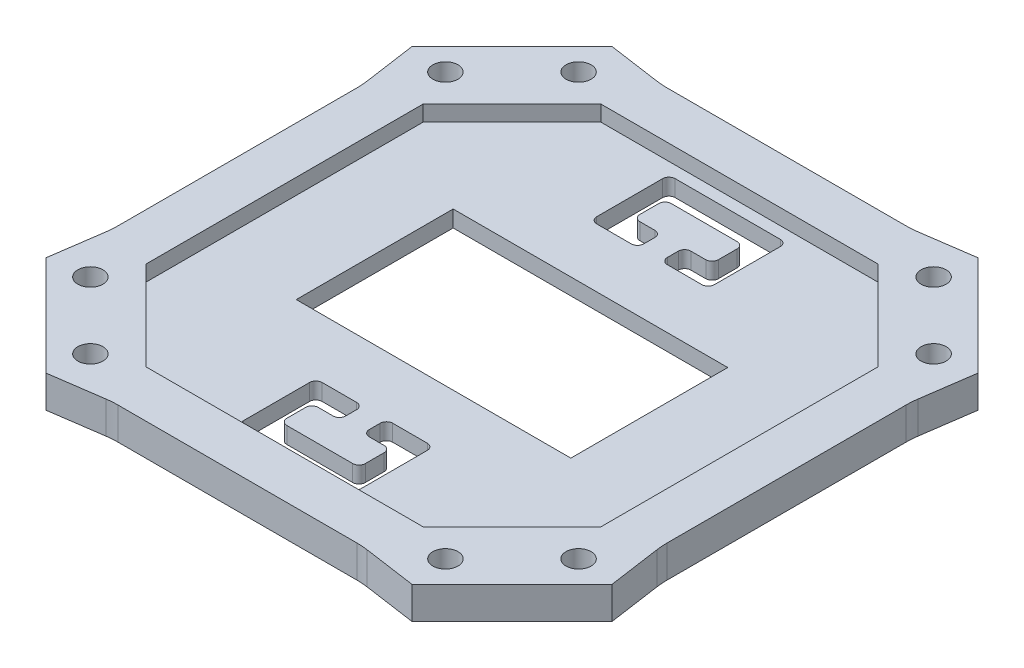
from build123d import *

# Parameters (mm, degrees)
SKETCH1_R           = 1.6
BOSS_EXTRUDE1_DEPTH = 4.1
CUT_EXTRUDE1_DEPTH  = 2
FILLET2_R           = 10
CUT_EXTRUDE4_DEPTH  = 52.043216983
SKETCH7_W           = 35
SKETCH7_H           = 20
CUT_EXTRUDE5_DEPTH  = 52.043216983


with BuildPart() as part:
    # Sketch1 → Boss-Extrude1 (new body)
    with BuildSketch(Plane(origin=(0, 0, 0), x_dir=(1, 0, 0), z_dir=(0, 1, 0))):
        Polygon((15.934040652, 35), (-15.934040652, 35), (-23.334523779, 36.062445841), (-36.062445841, 23.334523779), (-35, 15.934040652), (-35, -15.934040652), (-36.062445841, -23.334523779), (-23.334523779, -36.062445841), (-15.934040652, -35), (15.934040652, -35), (23.334523779, -36.062445841), (36.062445841, -23.334523779), (35, -15.934040652), (35, 15.934040652), (36.062445841, 23.334523779), (23.334523779, 36.062445841), align=None)
        with Locations((22.627416998, 31.112698372)):
            Circle(SKETCH1_R, mode=Mode.SUBTRACT)
        with Locations((31.112698372, 22.627416998)):
            Circle(SKETCH1_R, mode=Mode.SUBTRACT)
        with Locations((22.627416998, -31.112698372)):
            Circle(SKETCH1_R, mode=Mode.SUBTRACT)
        with Locations((31.112698372, -22.627416998)):
            Circle(SKETCH1_R, mode=Mode.SUBTRACT)
        with Locations((-31.112698372, -22.627416998)):
            Circle(SKETCH1_R, mode=Mode.SUBTRACT)
        with Locations((-22.627416998, -31.112698372)):
            Circle(SKETCH1_R, mode=Mode.SUBTRACT)
        with Locations((-22.627416998, 31.112698372)):
            Circle(SKETCH1_R, mode=Mode.SUBTRACT)
        with Locations((-31.112698372, 22.627416998)):
            Circle(SKETCH1_R, mode=Mode.SUBTRACT)
    extrude(amount=BOSS_EXTRUDE1_DEPTH)

    # Sketch2 → Cut-Extrude1 (cut)
    with BuildSketch(Plane(origin=(0, 4.1, 0), x_dir=(1, 0, 0), z_dir=(0, 1, 0))):
        Polygon((-17.669047558, 29), (17.669047558, 29), (29, 17.669047558), (29, -17.669047558), (17.669047558, -29), (-17.669047558, -29), (-29, -17.669047558), (-29, 17.669047558), align=None)
    extrude(amount=-CUT_EXTRUDE1_DEPTH, mode=Mode.SUBTRACT)

    # Fillet2
    fillet2_edges = [part.edges().sort_by_distance(p)[0] for p in [
        (-15.934040652, 2.05, -35),
        (15.934040652, 2.05, -35),
        (35, 2.05, -15.934040652),
        (35, 2.05, 15.934040652),
        (-35, 2.05, -15.934040652),
        (-35, 2.05, 15.934040652),
        (15.934040652, 2.05, 35),
        (-15.934040652, 2.05, 35),
    ]]
    fillet(fillet2_edges, radius=FILLET2_R)

    # Sketch6 → Cut-Extrude4 (cut, through all)
    with BuildSketch(Plane(origin=(0, 2.1, 0), x_dir=(1, 0, 0), z_dir=(0, 1, 0))):
        with BuildLine():
            Line((-1.5, 19.7), (-1.5, 18.3))
            ThreePointArc((-1.5, 18.3), (-1.734314575, 17.734314575), (-2.3, 17.5))
            Line((-2.3, 17.5), (-6.7, 17.5))
            ThreePointArc((-6.7, 17.5), (-7.265685425, 17.734314575), (-7.5, 18.3))
            Line((-7.5, 18.3), (-7.5, 26.7))
            ThreePointArc((-7.5, 26.7), (-7.265685425, 27.265685425), (-6.7, 27.5))
            Line((-6.7, 27.5), (6.7, 27.5))
            ThreePointArc((6.7, 27.5), (7.265685425, 27.265685425), (7.5, 26.7))
            Line((7.5, 26.7), (7.5, 18.3))
            ThreePointArc((7.5, 18.3), (7.265685425, 17.734314575), (6.7, 17.5))
            Line((6.7, 17.5), (2.3, 17.5))
            ThreePointArc((2.3, 17.5), (1.734314575, 17.734314575), (1.5, 18.3))
            Line((1.5, 18.3), (1.5, 19.7))
            ThreePointArc((1.5, 19.7), (1.734314575, 20.265685425), (2.3, 20.5))
            Line((2.3, 20.5), (4.2, 20.5))
            ThreePointArc((4.2, 20.5), (4.765685425, 20.734314575), (5, 21.3))
            Line((5, 21.3), (5, 23.7))
            ThreePointArc((5, 23.7), (4.765685425, 24.265685425), (4.2, 24.5))
            Line((4.2, 24.5), (-4.2, 24.5))
            ThreePointArc((-4.2, 24.5), (-4.765685425, 24.265685425), (-5, 23.7))
            Line((-5, 23.7), (-5, 21.3))
            ThreePointArc((-5, 21.3), (-4.765685425, 20.734314575), (-4.2, 20.5))
            Line((-4.2, 20.5), (-2.3, 20.5))
            ThreePointArc((-2.3, 20.5), (-1.734314575, 20.265685425), (-1.5, 19.7))
        make_face()
        with BuildLine():
            Line((2.3, -17.5), (6.7, -17.5))
            ThreePointArc((6.7, -17.5), (7.265685425, -17.734314575), (7.5, -18.3))
            Line((7.5, -18.3), (7.5, -26.7))
            ThreePointArc((7.5, -26.7), (7.265685425, -27.265685425), (6.7, -27.5))
            Line((6.7, -27.5), (-6.7, -27.5))
            ThreePointArc((-6.7, -27.5), (-7.265685425, -27.265685425), (-7.5, -26.7))
            Line((-7.5, -26.7), (-7.5, -18.3))
            ThreePointArc((-7.5, -18.3), (-7.265685425, -17.734314575), (-6.7, -17.5))
            Line((-6.7, -17.5), (-2.3, -17.5))
            ThreePointArc((-2.3, -17.5), (-1.734314575, -17.734314575), (-1.5, -18.3))
            Line((-1.5, -18.3), (-1.5, -19.7))
            ThreePointArc((-1.5, -19.7), (-1.734314575, -20.265685425), (-2.3, -20.5))
            Line((-2.3, -20.5), (-4.2, -20.5))
            ThreePointArc((-4.2, -20.5), (-4.765685425, -20.734314575), (-5, -21.3))
            Line((-5, -21.3), (-5, -23.7))
            ThreePointArc((-5, -23.7), (-4.765685425, -24.265685425), (-4.2, -24.5))
            Line((-4.2, -24.5), (4.2, -24.5))
            ThreePointArc((4.2, -24.5), (4.765685425, -24.265685425), (5, -23.7))
            Line((5, -23.7), (5, -21.3))
            ThreePointArc((5, -21.3), (4.765685425, -20.734314575), (4.2, -20.5))
            Line((4.2, -20.5), (2.3, -20.5))
            ThreePointArc((2.3, -20.5), (1.734314575, -20.265685425), (1.5, -19.7))
            Line((1.5, -19.7), (1.5, -18.3))
            ThreePointArc((1.5, -18.3), (1.734314575, -17.734314575), (2.3, -17.5))
        make_face()
    extrude(amount=-CUT_EXTRUDE4_DEPTH, mode=Mode.SUBTRACT)

    # Sketch7 → Cut-Extrude5 (cut, through all)
    with BuildSketch(Plane(origin=(0, 2.1, 0), x_dir=(1, 0, 0), z_dir=(0, 1, 0))):
        Rectangle(SKETCH7_W, SKETCH7_H)
    extrude(amount=-CUT_EXTRUDE5_DEPTH, mode=Mode.SUBTRACT)


solid = part.part
